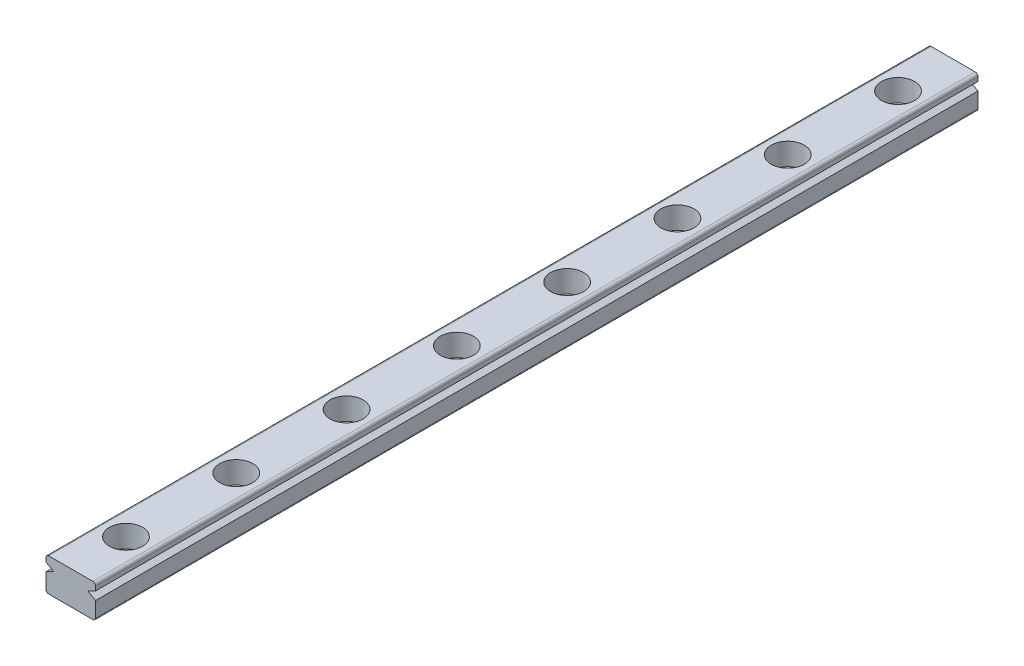
from build123d import *

# Parameters (mm, degrees)
BOSS_EXTRUDE1_DEPTH = 160
FILLET1_R           = 0.5
SKETCH2_R           = 3
CUT_EXTRUDE1_DEPTH  = 4
SKETCH3_R           = 1.75
CUT_EXTRUDE2_DEPTH  = 161.113241176
LPATTERN1_COUNT     = 8
LPATTERN1_PITCH     = 20


with BuildPart() as part:
    # Sketch1 → Boss-Extrude1 (new body)
    with BuildSketch(Plane.XY):
        Polygon((-4.5, 0), (4.5, 0), (4.5, 3.25), (3.1, 4), (4.5, 4.75), (4.5, 6), (-4.5, 6), (-4.5, 4.75), (-3.1, 4), (-4.5, 3.25), align=None)
    extrude(amount=BOSS_EXTRUDE1_DEPTH)

    # Fillet1
    fillet1_edges = [part.edges().sort_by_distance(p)[0] for p in [
        (-4.5, 6, 80),
        (4.5, 6, 80),
        (4.5, 0, 80),
        (-4.5, 0, 80),
    ]]
    fillet(fillet1_edges, radius=FILLET1_R)

    # Sketch2 → Cut-Extrude1 (cut)
    with BuildSketch(Plane(origin=(0, 6, 0), x_dir=(1, 0, 0), z_dir=(0, 1, 0))):
        with Locations(Location((0, -10, 0), (0, 0, 180))):
            Circle(SKETCH2_R)
    cut_extrude1 = extrude(amount=-CUT_EXTRUDE1_DEPTH, mode=Mode.SUBTRACT)

    # Sketch3 → Cut-Extrude2 (cut, through all)
    with BuildSketch(Plane(origin=(0, 2, 0), x_dir=(1, 0, 0), z_dir=(0, 1, 0))):
        with Locations(Location((0, -10, 0), (0, 0, 180))):
            Circle(SKETCH3_R)
    cut_extrude2 = extrude(amount=-CUT_EXTRUDE2_DEPTH, mode=Mode.SUBTRACT)

    # LPattern1: Cut-Extrude1, Cut-Extrude2 ×8
    with Locations(*[(0, 0, i * LPATTERN1_PITCH) for i in range(1, LPATTERN1_COUNT)]):
        add(cut_extrude1, mode=Mode.SUBTRACT)
        add(cut_extrude2, mode=Mode.SUBTRACT)


solid = part.part
